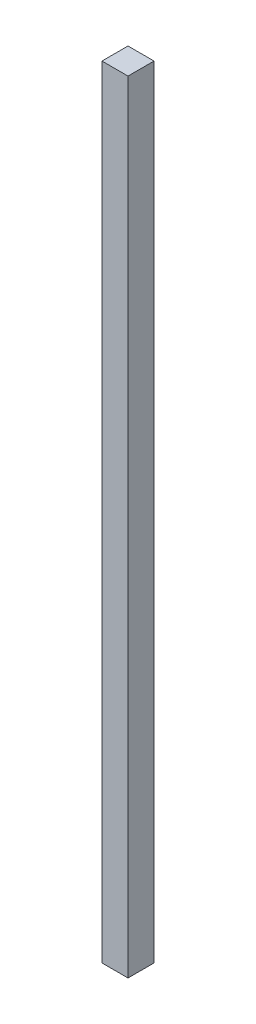
from build123d import *

# Parameters (mm, degrees)
SKETCH1_W           = 5
SKETCH1_H           = 5
BOSS_EXTRUDE1_DEPTH = 150


with BuildPart() as part:
    # Sketch1 → Boss-Extrude1 (new body)
    with BuildSketch(Plane(origin=(0, 0, 0), x_dir=(1, 0, 0), z_dir=(0, 1, 0))):
        Rectangle(SKETCH1_W, SKETCH1_H)
    extrude(amount=BOSS_EXTRUDE1_DEPTH)


solid = part.part
